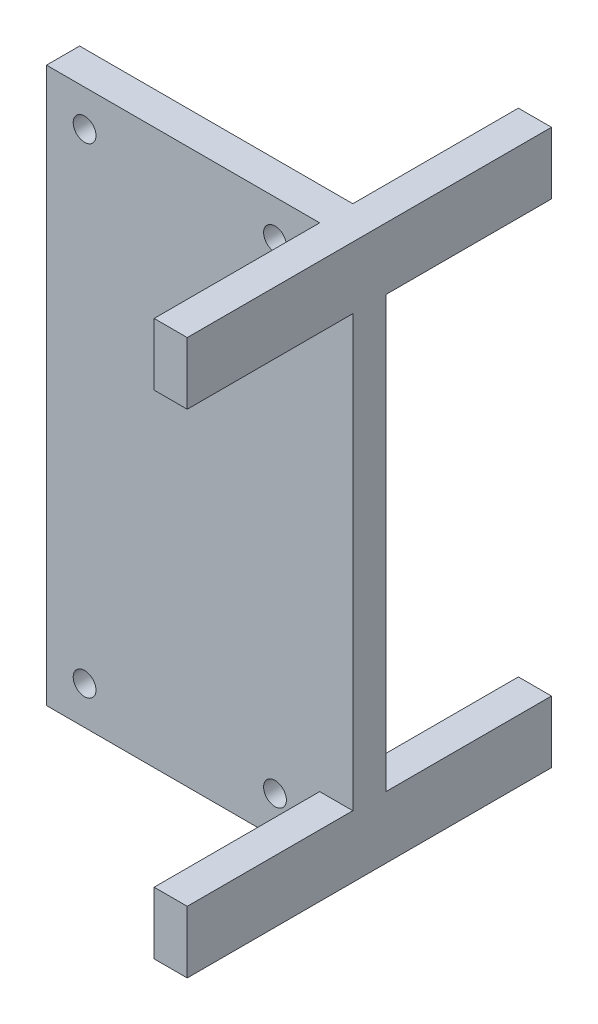
from build123d import *

# Parameters (mm, degrees)
SZKIC2_W                    = 32
SZKIC2_H                    = 67
SZKIC2_R                    = 1.375000051
SZKIC2_R_2                  = 1.375001066
SZKIC2_R_3                  = 1.375000054
SZKIC2_R_4                  = 1.374997602
SZKIC2_W_2                  = 5
DODANIE_WYCI_GNI_CIE1_DEPTH = 4
SZKIC7_W                    = 20
SZKIC7_H                    = 7.5
DODANIE_WYCI_GNI_CIE2_DEPTH = 4


with BuildPart() as part:
    # Szkic2 → Dodanie-wyciągnięcie1 (new body)
    # profile 1 of 2: a face of its own
    with BuildSketch(Plane.XY):
        with Locations((16, 33.5)):
            Rectangle(SZKIC2_W, SZKIC2_H)
        with Locations((4.59999689, 4.59999658)):
            Circle(SZKIC2_R, mode=Mode.SUBTRACT)
        with Locations((27.600003502, 4.59999658)):
            Circle(SZKIC2_R_2, mode=Mode.SUBTRACT)
        with Locations((4.600005213, 62.599996076)):
            Circle(SZKIC2_R_3, mode=Mode.SUBTRACT)
        with Locations((27.600003502, 62.599996076)):
            Circle(SZKIC2_R_4, mode=Mode.SUBTRACT)
    # profile 2 of 2: a face of its own
    with BuildSketch(Plane.XY):
        with Locations((34.5, 33.5)):
            Rectangle(SZKIC2_W_2, SZKIC2_H)
    extrude(amount=DODANIE_WYCI_GNI_CIE1_DEPTH)

    # Szkic7 → Dodanie-wyciągnięcie2 (add)
    with BuildSketch(Plane(origin=(37, 0, 0), x_dir=(0, 0, -1), z_dir=(1, 0, 0))):
        with Locations((-14, 3.75)):
            Rectangle(SZKIC7_W, SZKIC7_H)
        with Locations((10, 3.75)):
            Rectangle(SZKIC7_W, SZKIC7_H)
        with Locations((-14, 63.25)):
            Rectangle(SZKIC7_W, SZKIC7_H)
        with Locations((10, 63.25)):
            Rectangle(SZKIC7_W, SZKIC7_H)
    extrude(amount=-DODANIE_WYCI_GNI_CIE2_DEPTH)


solid = part.part
